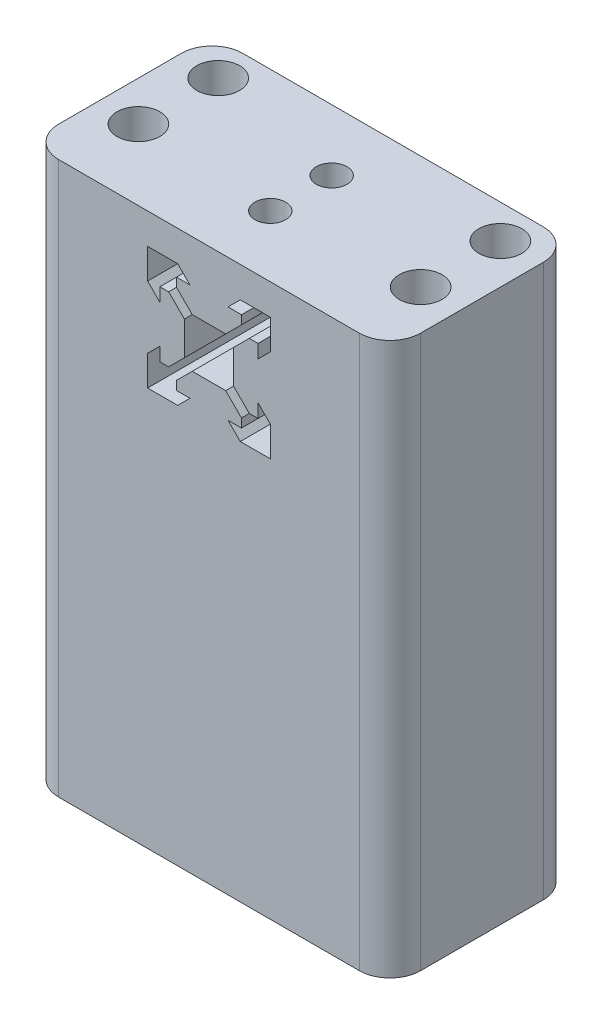
from build123d import *

# Parameters (mm, degrees)
SKETCH1_W           = 59
SKETCH1_H           = 30
BOSS_EXTRUDE1_DEPTH = 30
SKETCH2_R           = 2.5
SKETCH2_R_2         = 3.5
CUT_EXTRUDE1_DEPTH  = 52.674461778
SKETCH3_W           = 59
SKETCH3_H           = 60
BOSS_EXTRUDE2_DEPTH = 30
FILLET1_R           = 5
FILLET2_R           = 5
FILLET3_R           = 5
FILLET4_R           = 5


with BuildPart() as part:
    # Sketch1 → Boss-Extrude1 (new body)
    with BuildSketch(Plane.XY):
        Rectangle(SKETCH1_W, SKETCH1_H)
        Polygon((4, 2.727207794), (6.572792206, 5.3), (8, 5.3), (8, 3.1), (10, 5.1), (10, 10), (5.1, 10), (3.1, 8), (5.3, 8), (5.3, 6.572792206), (2.727207794, 4), (-2.727207794, 4), (-5.3, 6.572792206), (-5.3, 8), (-3.1, 8), (-5.1, 10), (-10, 10), (-10, 5.1), (-8, 3.1), (-8, 5.3), (-6.572792206, 5.3), (-4, 2.727207794), (-4, -2.727207794), (-6.572792206, -5.3), (-8, -5.3), (-8, -3.1), (-10, -5.1), (-10, -10), (-5.1, -10), (-3.1, -8), (-5.3, -8), (-5.3, -6.572792206), (-2.727207794, -4), (2.727207794, -4), (5.3, -6.572792206), (5.3, -8), (3.1, -8), (5.1, -10), (10, -10), (10, -5.1), (8, -3.1), (8, -5.3), (6.572792206, -5.3), (4, -2.727207794), align=None, mode=Mode.SUBTRACT)
    extrude(amount=-BOSS_EXTRUDE1_DEPTH)

    # Sketch2 → Cut-Extrude1 (cut, through all)
    with BuildSketch(Plane(origin=(0, 15, 0), x_dir=(1, 0, 0), z_dir=(0, 1, 0))):
        with Locations(Location((0, 10, 0), (0, 0, 270))):
            Circle(SKETCH2_R)
        with Locations(Location((0, 20, 0), (0, 0, 270))):
            Circle(SKETCH2_R)
        with Locations(Location((-23, 24.5, 0), (0, 0, 270))):
            Circle(SKETCH2_R_2)
        with Locations(Location((23, 24.5, 0), (0, 0, 270))):
            Circle(SKETCH2_R_2)
        with Locations(Location((23, 11.5, 0), (0, 0, 270))):
            Circle(SKETCH2_R_2)
        with Locations(Location((-23, 11.5, 0), (0, 0, 270))):
            Circle(SKETCH2_R_2)
    extrude(amount=-CUT_EXTRUDE1_DEPTH, mode=Mode.SUBTRACT)

    # Sketch3 → Boss-Extrude2 (add)
    with BuildSketch(Plane.XY):
        with Locations((0, -45)):
            Rectangle(SKETCH3_W, SKETCH3_H)
    extrude(amount=-BOSS_EXTRUDE2_DEPTH)

    # Fillet1
    fillet1_edges = [part.edges().sort_by_distance(p)[0] for p in [
        (29.5, -30, 0),
    ]]
    fillet(fillet1_edges, radius=FILLET1_R)

    # Fillet2
    fillet2_edges = [part.edges().sort_by_distance(p)[0] for p in [
        (29.5, -30, -30),
    ]]
    fillet(fillet2_edges, radius=FILLET2_R)

    # Fillet3
    fillet3_edges = [part.edges().sort_by_distance(p)[0] for p in [
        (-29.5, -30, -30),
    ]]
    fillet(fillet3_edges, radius=FILLET3_R)

    # Fillet4
    fillet4_edges = [part.edges().sort_by_distance(p)[0] for p in [
        (-29.5, -30, 0),
    ]]
    fillet(fillet4_edges, radius=FILLET4_R)


solid = part.part
